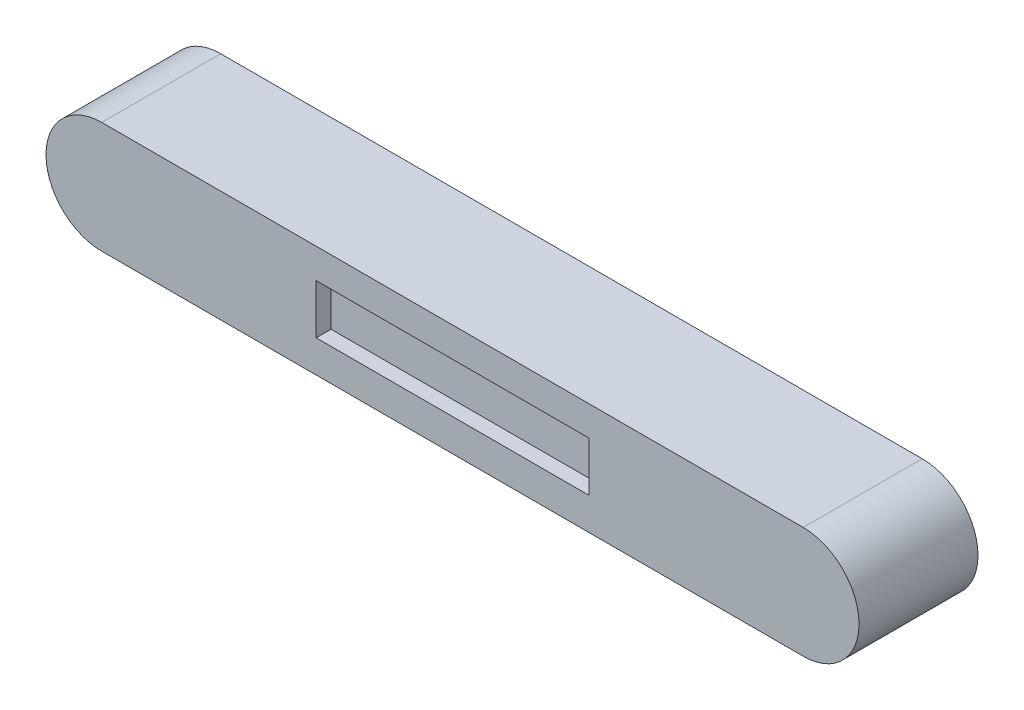
from build123d import *

# Parameters (mm, degrees)
SKETCH_1_W          = 164
SKETCH_1_H          = 22.5
EXTRUDE_1_DEPTH     = 24
CUT_EXTRUDE_1_DEPTH = 24
SKETCH_3_W          = 55
SKETCH_3_H          = 10
CUT_EXTRUDE_2_DEPTH = 3


with BuildPart() as part:
    # 草图1 → 凸台-拉伸1 (new body)
    with BuildSketch(Plane.XY):
        with Locations((82, 11.25)):
            Rectangle(SKETCH_1_W, SKETCH_1_H)
    extrude(amount=EXTRUDE_1_DEPTH)

    # 草图2 → 切除-拉伸1 (cut)
    with BuildSketch(Plane.XY.offset(24)):
        with BuildLine():
            ThreePointArc((0, 11.25), (3.295048712, 19.204951288), (11.25, 22.5))
            Line((11.25, 22.5), (0, 22.5))
            Line((0, 22.5), (0, 11.25))
        make_face()
        with BuildLine():
            ThreePointArc((11.25, 0), (3.295048712, 3.295048712), (0, 11.25))
            Line((0, 11.25), (0, 0))
            Line((0, 0), (11.25, 0))
        make_face()
        with BuildLine():
            Line((164, 22.5), (152.75, 22.5))
            ThreePointArc((152.75, 22.5), (160.704951288, 19.204951288), (164, 11.25))
            Line((164, 11.25), (164, 22.5))
        make_face()
        with BuildLine():
            Line((164, 0), (164, 11.25))
            ThreePointArc((164, 11.25), (160.704951288, 3.295048712), (152.75, 0))
            Line((152.75, 0), (164, 0))
        make_face()
    extrude(amount=-CUT_EXTRUDE_1_DEPTH, mode=Mode.SUBTRACT)

    # 草图3 → 切除-拉伸2 (cut)
    with BuildSketch(Plane.XY.offset(24)):
        with Locations((82, 11.5)):
            Rectangle(SKETCH_3_W, SKETCH_3_H)
    extrude(amount=-CUT_EXTRUDE_2_DEPTH, mode=Mode.SUBTRACT)


solid = part.part
